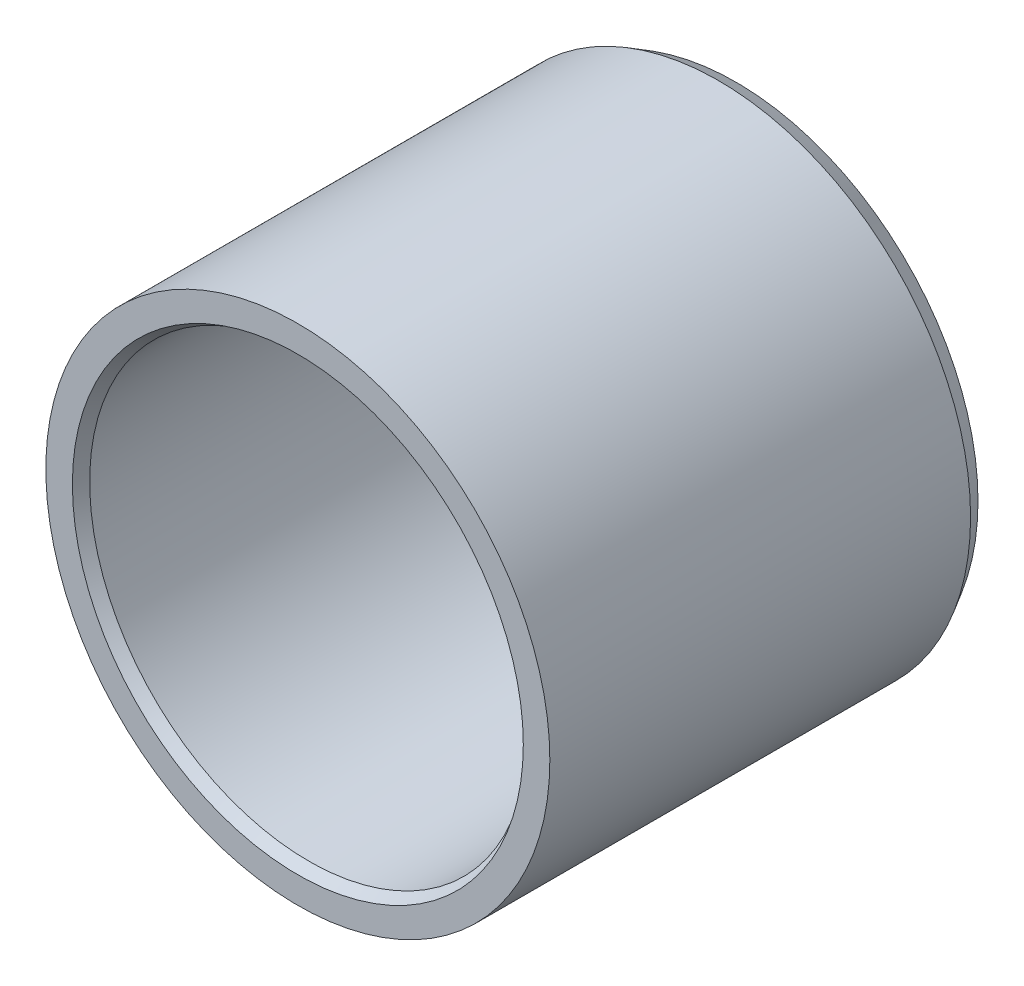
from build123d import *

# Parameters (mm, degrees)
SKICA1_R        = 11.5
SKICA1_R_2      = 10
VYSUNOUT1_DEPTH = 20
ZKOSIT1_SIZE    = 0.5
ZKOSIT1_SIZE2   = 0.288675135
ZKOSIT2_SIZE    = 0.461880215
ZKOSIT2_SIZE2   = 0.8


with BuildPart() as part:
    # Skica1 → Vysunout1 (new body)
    with BuildSketch(Plane.XY):
        Circle(SKICA1_R)
        Circle(SKICA1_R_2, mode=Mode.SUBTRACT)
    extrude(amount=VYSUNOUT1_DEPTH)

    # Zkosit1
    zkosit1_edges = [part.edges().sort_by_distance(p)[0] for p in [
        (-10, 0, 20),
    ]]
    zkosit1_side = [part.faces().sort_by_distance(p)[0] for p in [
        (-10, 0, 10),
    ]]
    chamfer(zkosit1_edges, length=ZKOSIT1_SIZE, length2=ZKOSIT1_SIZE2, reference=zkosit1_side[0])

    # Zkosit2
    zkosit2_edges = [part.edges().sort_by_distance(p)[0] for p in [
        (-11.5, 0, 0),
    ]]
    zkosit2_side = [part.faces().sort_by_distance(p)[0] for p in [
        (-11.174730881, 0, 0),
    ]]
    chamfer(zkosit2_edges, length=ZKOSIT2_SIZE, length2=ZKOSIT2_SIZE2, reference=zkosit2_side[0])


solid = part.part
